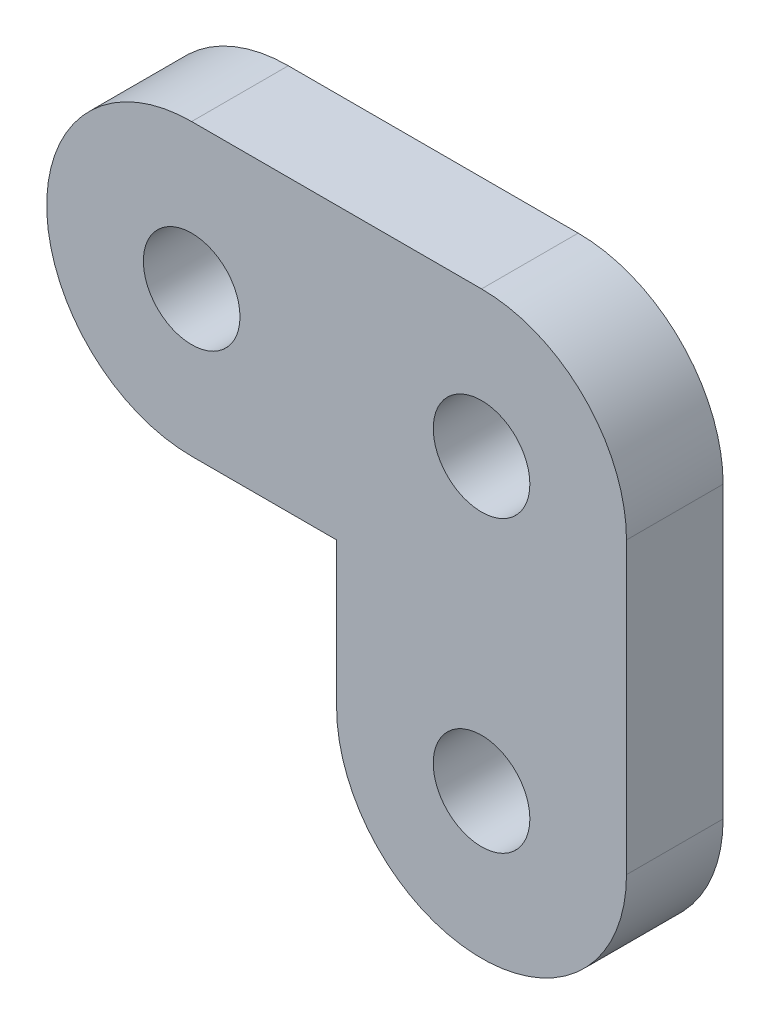
from build123d import *

# Parameters (mm, degrees)
MODEL_R                 = 1.5
SALIENTE_EXTRUIR1_DEPTH = 3


with BuildPart() as part:
    # Model → Saliente-Extruir1 (new body)
    with BuildSketch(Plane.XY):
        with BuildLine():
            Line((149.34213351, 211.823953209), (158.34213351, 211.823953209))
            ThreePointArc((158.34213351, 211.823953209), (161.524114025, 210.505933724), (162.84213351, 207.323953209))
            Line((162.84213351, 207.323953209), (162.84213351, 198.323953209))
            ThreePointArc((162.84213351, 198.323953209), (158.34213351, 193.823953209), (153.84213351, 198.323953209))
            Line((153.84213351, 198.323953209), (153.84213351, 202.823953209))
            Line((153.84213351, 202.823953209), (149.34213351, 202.823953209))
            ThreePointArc((149.34213351, 202.823953209), (144.84213351, 207.323953209), (149.34213351, 211.823953209))
        make_face()
        with Locations((149.34213351, 207.323953209)):
            Circle(MODEL_R, mode=Mode.SUBTRACT)
        with Locations((158.34213351, 207.323953209)):
            Circle(MODEL_R, mode=Mode.SUBTRACT)
        with Locations((158.34213351, 198.323953209)):
            Circle(MODEL_R, mode=Mode.SUBTRACT)
    extrude(amount=SALIENTE_EXTRUIR1_DEPTH)


solid = part.part
